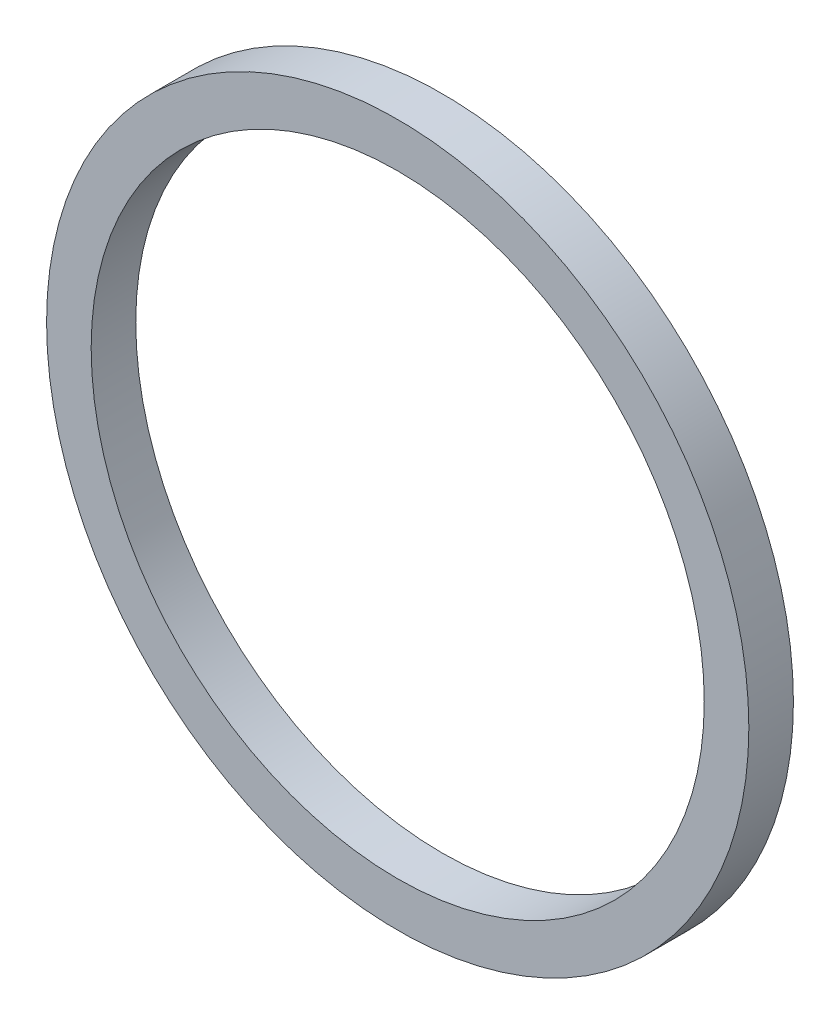
from build123d import *

# Parameters (mm, degrees)
SKETCH_1_R      = 63
SKETCH_1_R_2    = 55
EXTRUDE_1_DEPTH = 8


with BuildPart() as part:
    # 草图1 → 凸台-拉伸1 (new body)
    with BuildSketch(Plane.XY):
        Circle(SKETCH_1_R)
        Circle(SKETCH_1_R_2, mode=Mode.SUBTRACT)
    extrude(amount=EXTRUDE_1_DEPTH)


solid = part.part
